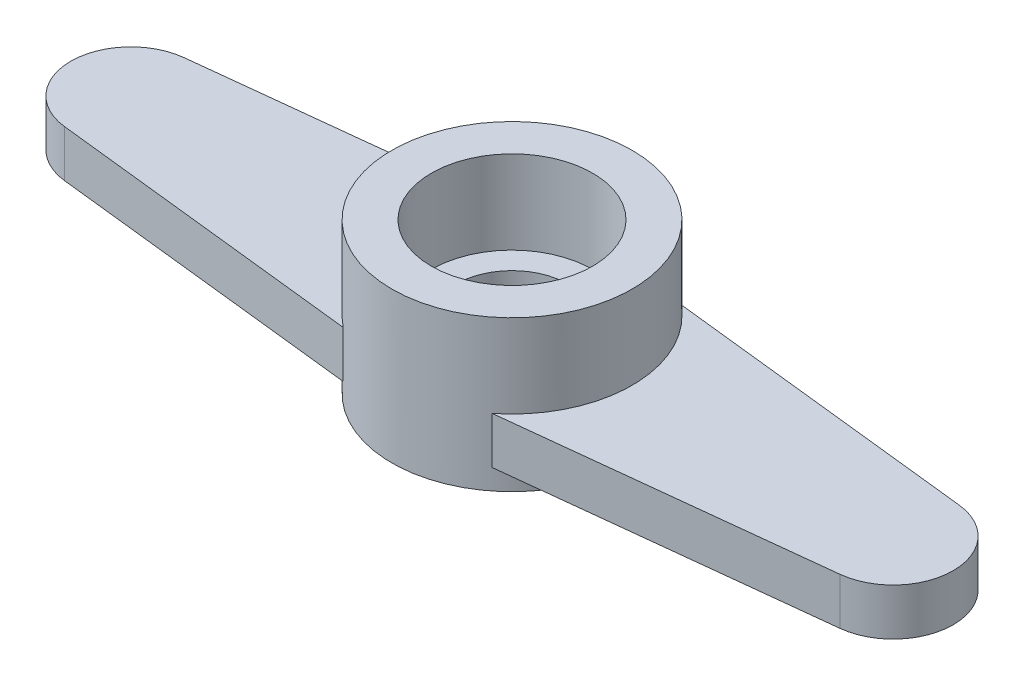
from build123d import *
from build123d.topology import SkipClean

# Parameters (mm, degrees)
SKETCH2_R           = 1.975
SKETCH2_R_2         = 3.95
BOSS_EXTRUDE2_DEPTH = 1.54
SKETCH3_R           = 3.95
BOSS_EXTRUDE3_DEPTH = 2.74
BOSS_EXTRUDE4_START = 0.67
SKETCH4_R           = 3.95
BOSS_EXTRUDE4_DEPTH = 0.67
SKETCH5_R           = 2.65
CUT_EXTRUDE1_DEPTH  = 2.74
SKETCH6_R           = 3.45
CUT_EXTRUDE2_DEPTH  = 0.67
SKETCH7_R           = 1.825
CUT_EXTRUDE3_DEPTH  = 16.276128436


with BuildPart() as part:
    # Sketch2 → Boss-Extrude2 (new body)
    with BuildSketch(Plane(origin=(0, 0, 0), x_dir=(1, 0, 0), z_dir=(0, 1, 0))):
        with BuildLine():
            ThreePointArc((-2.447958333, -3.1), (-3.95, 0), (-2.447958333, 3.1))
            Line((-2.447958333, 3.1), (-12.741816497, 1.963062813))
            ThreePointArc((-12.741816497, 1.963062813), (-11.207348222, 1.471196381), (-10.55, 0))
            ThreePointArc((-10.55, 0), (-11.207348221, -1.471196381), (-12.741816497, -1.963062813))
            Line((-12.741816497, -1.963062813), (-2.447958333, -3.1))
        make_face()
        with Locations((-12.525, 0)):
            Circle(SKETCH2_R)
        Circle(SKETCH2_R_2)
        with BuildLine():
            Line((12.741816497, 1.963062813), (2.447958333, 3.1))
            ThreePointArc((2.447958333, 3.1), (3.554710636, 1.722362416), (3.95, 0))
            ThreePointArc((3.95, 0), (3.554710636, -1.722362416), (2.447958333, -3.1))
            Line((2.447958333, -3.1), (12.741816531, -1.963062809))
            ThreePointArc((12.741816531, -1.963062809), (10.55, -1.7e-08), (12.741816497, 1.963062813))
        make_face()
        with BuildLine():
            ThreePointArc((14.5, 0), (13.996196381, 1.317651778), (12.741816497, 1.963062813))
            ThreePointArc((12.741816497, 1.963062813), (10.55, -1.7e-08), (12.741816531, -1.963062809))
            ThreePointArc((12.741816531, -1.963062809), (13.996196392, -1.317651766), (14.5, 0))
        make_face()
    extrude(amount=BOSS_EXTRUDE2_DEPTH)

    # Sketch3 → Boss-Extrude3 (add)
    with BuildSketch(Plane(origin=(0, 1.54, 0), x_dir=(1, 0, 0), z_dir=(0, 1, 0))):
        with Locations(Location((0, 0, 0), (0, 0, 128.296879298))):
            Circle(SKETCH3_R)
    extrude(amount=BOSS_EXTRUDE3_DEPTH)

    # Sketch4 → Boss-Extrude4 (add)
    with SkipClean():  # the faces are left unmerged after this step: merging them gives an invalid solid
        with BuildSketch(Plane(origin=(0, 0, 0), x_dir=(-1, 0, 0), z_dir=(0, -1, 0)).offset(BOSS_EXTRUDE4_START)):
            with Locations(Location((0, 0, 0), (0, 0, 90))):
                Circle(SKETCH4_R)
        extrude(amount=-BOSS_EXTRUDE4_DEPTH)

    # Sketch5 → Cut-Extrude1 (cut)
    with SkipClean():  # the faces are left unmerged after this step: merging them gives an invalid solid
        with BuildSketch(Plane(origin=(0, 4.28, 0), x_dir=(1, 0, 0), z_dir=(0, 1, 0))):
            with Locations(Location((0, 0, 0), (0, 0, 270))):
                Circle(SKETCH5_R)
        extrude(amount=-CUT_EXTRUDE1_DEPTH, mode=Mode.SUBTRACT)

    # Sketch6 → Cut-Extrude2 (cut)
    with SkipClean():  # the faces are left unmerged after this step: merging them gives an invalid solid
        with BuildSketch(Plane(origin=(0, -0.67, 0), x_dir=(-1, 0, 0), z_dir=(0, -1, 0))):
            with Locations(Location((0, 0, 0), (0, 0, 90))):
                Circle(SKETCH6_R)
        extrude(amount=-CUT_EXTRUDE2_DEPTH, mode=Mode.SUBTRACT)

    # Sketch7 → Cut-Extrude3 (cut, through all)
    with SkipClean():  # the faces are left unmerged after this step: merging them gives an invalid solid
        with BuildSketch(Plane(origin=(0, 1.54, 0), x_dir=(1, 0, 0), z_dir=(0, 1, 0))):
            with Locations(Location((0, 0, 0), (0, 0, 270))):
                Circle(SKETCH7_R)
        extrude(amount=-CUT_EXTRUDE3_DEPTH, mode=Mode.SUBTRACT)


solid = part.part
